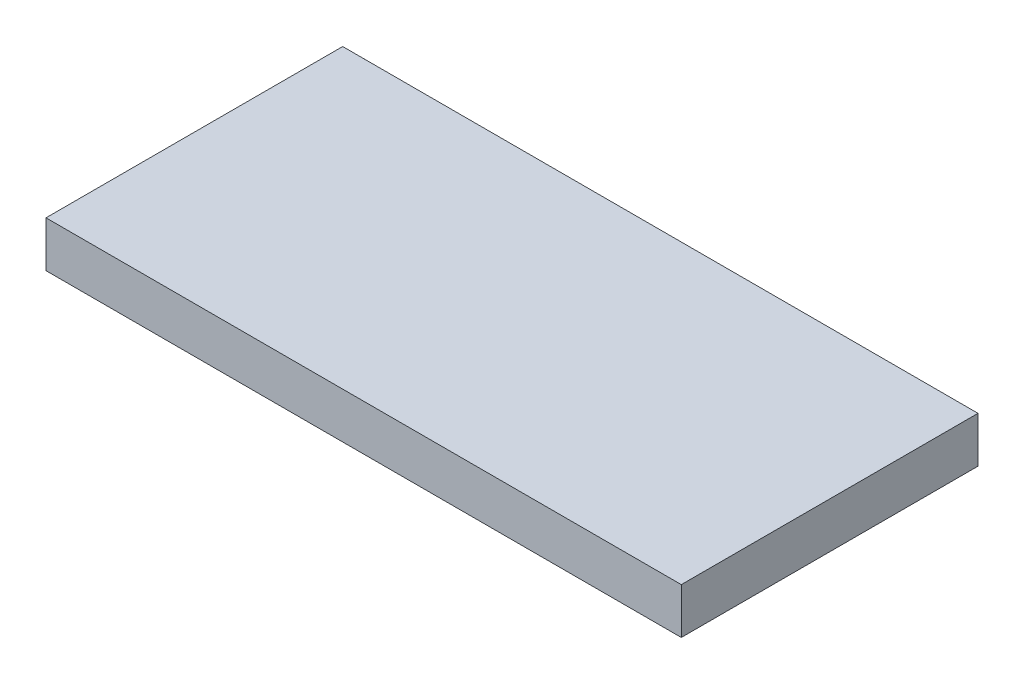
from build123d import *

# Parameters (mm, degrees)
SKETCH1_W      = 66.245820557
SKETCH1_H      = 30.9372
EXTRUDE1_DEPTH = 4.7752


with BuildPart() as part:
    # Sketch1 → Extrude1 (new body)
    with BuildSketch(Plane(origin=(0, 0, 0), x_dir=(1, 0, 0), z_dir=(0, 1, 0))):
        with Locations((33.122910279, 15.4686)):
            Rectangle(SKETCH1_W, SKETCH1_H)
    extrude(amount=-EXTRUDE1_DEPTH)


solid = part.part
